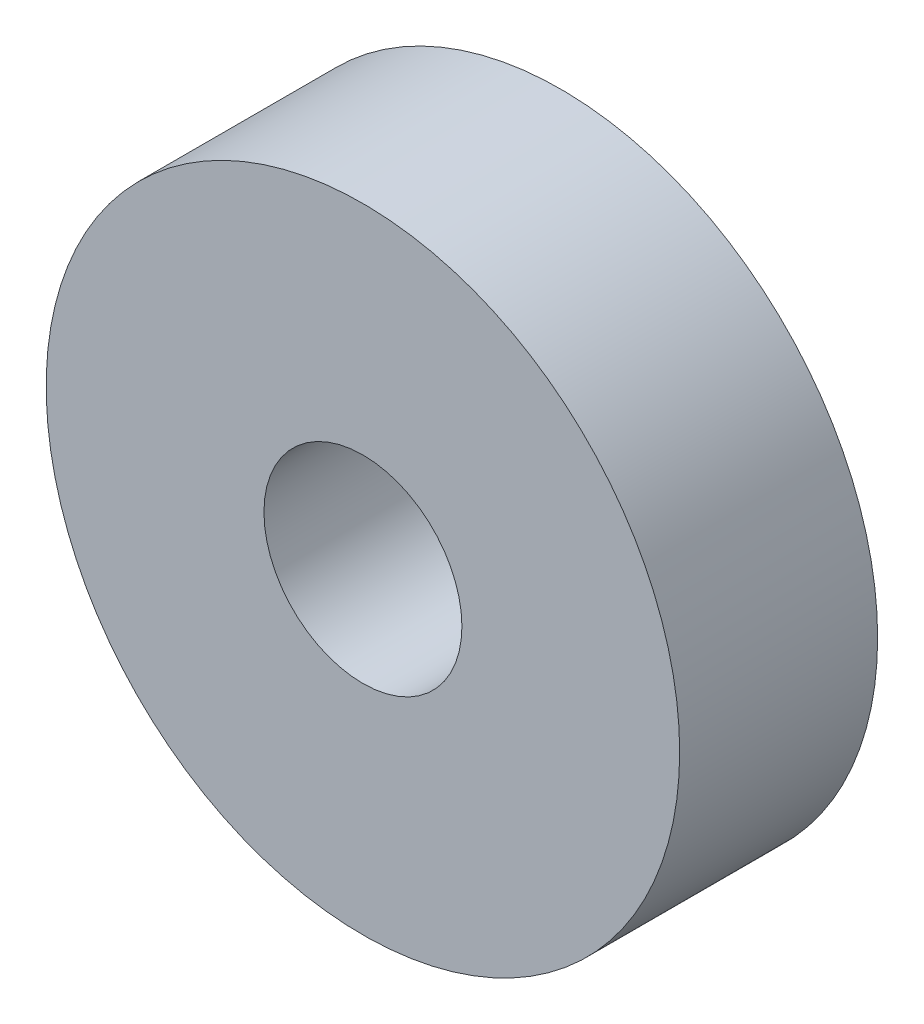
from build123d import *

# Parameters (mm, degrees)
ESBO_O1_R                = 8
ESBO_O1_R_2              = 2.5
RESSALTO_EXTRUS_O1_DEPTH = 5


with BuildPart() as part:
    # Esboço1 → Ressalto-extrusão1 (new body)
    with BuildSketch(Plane.XY):
        Circle(ESBO_O1_R)
        Circle(ESBO_O1_R_2, mode=Mode.SUBTRACT)
    extrude(amount=RESSALTO_EXTRUS_O1_DEPTH)


solid = part.part
